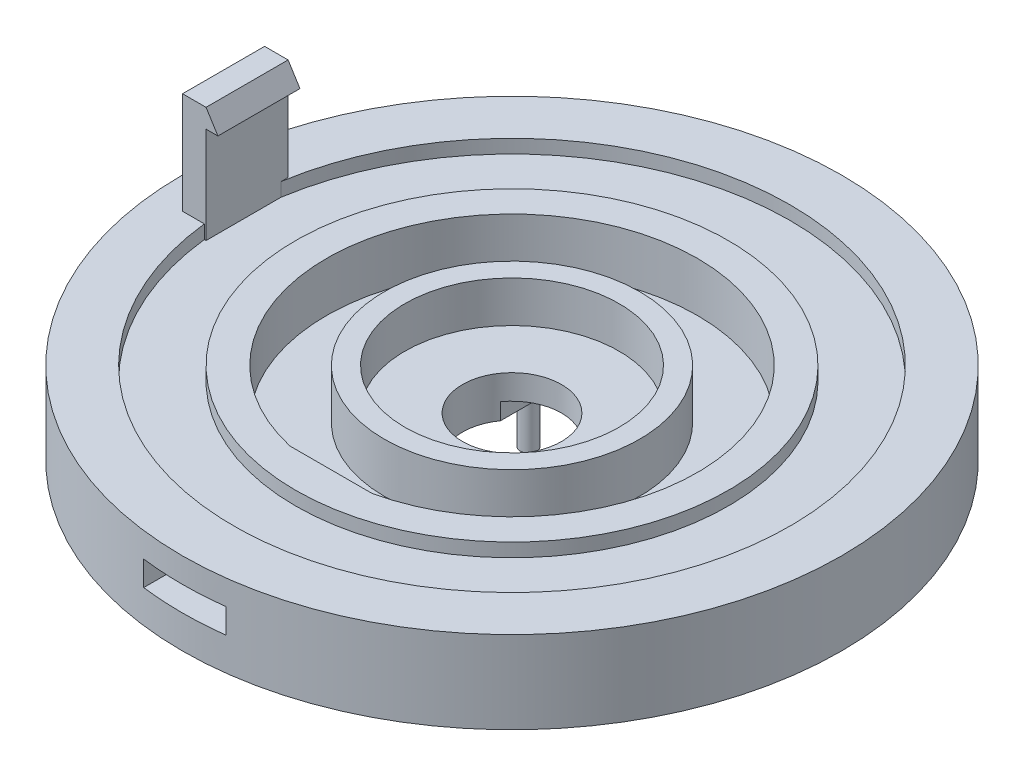
from build123d import *

# Parameters (mm, degrees)
SKETCH28_W                                   = 80
SKETCH28_H                                   = 80
BOSS_EXTRUDE1_DEPTH                          = 10
CBORE_FOR_M10_CHEESE_HEAD_SCREW1_D           = 12
CBORE_FOR_M10_CHEESE_HEAD_SCREW1_CBORE_D     = 26
CBORE_FOR_M10_CHEESE_HEAD_SCREW1_CBORE_DEPTH = 5
SKETCH36_R                                   = 1
BOSS_EXTRUDE5_DEPTH                          = 10
SKETCH37_R                                   = 22.5
SKETCH37_R_2                                 = 15.5
CUT_EXTRUDE2_DEPTH                           = 6
CUT_EXTRUDE6_DEPTH                           = 6
SKETCH40_W                                   = 18.062589032
SKETCH40_H                                   = 3
BOSS_EXTRUDE7_DEPTH                          = 13
SKETCH41_R                                   = 33.75
SKETCH41_R_2                                 = 26.25
CUT_EXTRUDE7_DEPTH                           = 1.65
SKETCH42_W                                   = 9.8
SKETCH42_H                                   = 11.037342061
CUT_EXTRUDE8_DEPTH                           = 2
CUT_EXTRUDE11_DEPTH                          = 20
SKETCH45_W                                   = 2.851047628
SKETCH45_H                                   = 9.955339391
BOSS_EXTRUDE8_DEPTH                          = 14
BOSS_EXTRUDE9_START                          = -9.955339
BOSS_EXTRUDE9_DEPTH                          = 9.955339


with BuildPart() as part:
    # Sketch28 → Boss-Extrude1 (new body)
    with BuildSketch(Plane(origin=(0, 0, 0), x_dir=(1, 0, 0), z_dir=(0, 1, 0))):
        with Locations((1.944585414, 4.241283073)):
            Rectangle(SKETCH28_W, SKETCH28_H)
    extrude(amount=BOSS_EXTRUDE1_DEPTH)

    # CBORE for M10 Cheese Head Screw1 (through all)
    with Locations(Plane(origin=(0, 10, 0), x_dir=(1, 0, 0), z_dir=(0, 1, 0))):
        with Locations((1.944585414, 4.241283073)):
            CounterBoreHole(CBORE_FOR_M10_CHEESE_HEAD_SCREW1_D / 2, CBORE_FOR_M10_CHEESE_HEAD_SCREW1_CBORE_D / 2, CBORE_FOR_M10_CHEESE_HEAD_SCREW1_CBORE_DEPTH)

    # Sketch36 → Boss-Extrude5 (add)
    with BuildSketch(Plane.XZ):
        with Locations(Location((12.444585414, -16.741283073, 0), (0, 0, 270))):
            Circle(SKETCH36_R)
        with Locations(Location((12.444585414, -4.241283073, 0), (0, 0, 270))):
            Circle(SKETCH36_R)
        with Locations(Location((-8.555414586, -16.741283073, 0), (0, 0, 90))):
            Circle(SKETCH36_R)
        with Locations(Location((-8.555414586, -4.241283073, 0), (0, 0, 90))):
            Circle(SKETCH36_R)
    extrude(amount=BOSS_EXTRUDE5_DEPTH)

    # Sketch37 → Cut-Extrude2 (cut)
    with BuildSketch(Plane(origin=(0, 10, 0), x_dir=(1, 0, 0), z_dir=(0, 1, 0))):
        with Locations(Location((1.944585414, 4.241283073, 0), (0, 0, 270))):
            Circle(SKETCH37_R)
        with Locations(Location((1.944585414, 4.241283073, 0), (0, 0, 270))):
            Circle(SKETCH37_R_2, mode=Mode.SUBTRACT)
    extrude(amount=-CUT_EXTRUDE2_DEPTH, mode=Mode.SUBTRACT)

    # Sketch39 → Cut-Extrude6 (cut)
    with BuildSketch(Plane(origin=(0, 10, 0), x_dir=(1, 0, 0), z_dir=(0, 1, 0))):
        with BuildLine():
            Line((6.944585414, -35.758716927), (6.944585414, -17.696127895))
            ThreePointArc((6.944585414, -17.696127895), (1.944585414, -18.258716927), (-3.055414586, -17.696127895))
            Line((-3.055414586, -17.696127895), (-3.055414586, -35.758716927))
            Line((-3.055414586, -35.758716927), (1.944585414, -35.758716927))
            Line((1.944585414, -35.758716927), (6.944585414, -35.758716927))
        make_face()
    extrude(amount=-CUT_EXTRUDE6_DEPTH, mode=Mode.SUBTRACT)

    # Sketch40 → Boss-Extrude7 (add)
    with BuildSketch(Plane(origin=(-3.055414586, 0, 0), x_dir=(0, 0, -1), z_dir=(1, 0, 0))):
        with Locations((-26.727422411, 8.5)):
            Rectangle(SKETCH40_W, SKETCH40_H)
    extrude(amount=BOSS_EXTRUDE7_DEPTH)

    # Sketch41 → Cut-Extrude7 (cut)
    with BuildSketch(Plane(origin=(0, 10, 0), x_dir=(1, 0, 0), z_dir=(0, 1, 0))):
        with Locations(Location((1.944585414, 4.241283073, 0), (0, 0, 270))):
            Circle(SKETCH41_R)
        with Locations(Location((1.944585414, 4.241283073, 0), (0, 0, 270))):
            Circle(SKETCH41_R_2, mode=Mode.SUBTRACT)
    extrude(amount=-CUT_EXTRUDE7_DEPTH, mode=Mode.SUBTRACT)

    # Sketch42 → Cut-Extrude8 (cut)
    with BuildSketch(Plane.XZ):
        with Locations((1.966640169, -13.109663986)):
            Rectangle(SKETCH42_W, SKETCH42_H)
    extrude(amount=-CUT_EXTRUDE8_DEPTH, mode=Mode.SUBTRACT)

    # Sketch43 → Cut-Extrude11 (cut)
    with BuildSketch(Plane(origin=(0, 10, 0), x_dir=(1, 0, 0), z_dir=(0, 1, 0))):
        with BuildLine():
            ThreePointArc((-38.055414586, 4.241282966), (-26.339685871, 32.525554283), (1.944585414, 44.241283073))
            Line((1.944585414, 44.241283073), (-38.055414586, 44.241283073))
            Line((-38.055414586, 44.241283073), (-38.055414586, 4.241282966))
        make_face()
        with BuildLine():
            ThreePointArc((1.944585414, -35.758716927), (-26.339685795, -24.042988212), (-38.055414586, 4.241282966))
            Line((-38.055414586, 4.241282966), (-38.055414586, -35.758716927))
            Line((-38.055414586, -35.758716927), (1.944585414, -35.758716927))
        make_face()
        with BuildLine():
            Line((41.944585414, -35.758716927), (41.944585414, 4.241283073))
            ThreePointArc((41.944585414, 4.241283073), (30.228856662, -24.042988174), (1.944585414, -35.758716927))
            Line((1.944585414, -35.758716927), (41.944585414, -35.758716927))
        make_face()
        with BuildLine():
            Line((41.944585414, 44.241283073), (1.944585414, 44.241283073))
            ThreePointArc((1.944585414, 44.241283073), (30.228856662, 32.525554321), (41.944585414, 4.241283073))
            Line((41.944585414, 4.241283073), (41.944585414, 44.241283073))
        make_face()
    extrude(amount=-CUT_EXTRUDE11_DEPTH, mode=Mode.SUBTRACT)

    # Sketch45 → Boss-Extrude8 (add)
    with BuildSketch(Plane(origin=(0, 8.35, 0), x_dir=(1, 0, 0), z_dir=(0, 1, 0))):
        with Locations((-32.810971356, 5.43037333)):
            Rectangle(SKETCH45_W, SKETCH45_H)
    extrude(amount=BOSS_EXTRUDE8_DEPTH)

    # Sketch46 → Boss-Extrude9 (add)
    with BuildSketch(Plane.XY.offset(-0.452703634).offset(BOSS_EXTRUDE9_START)):
        Polygon((-31.385447542, 22.35), (-31.385447542, 20.057188555), (-29.944471524, 20.057188555), align=None)
    extrude(amount=BOSS_EXTRUDE9_DEPTH)


solid = part.part
